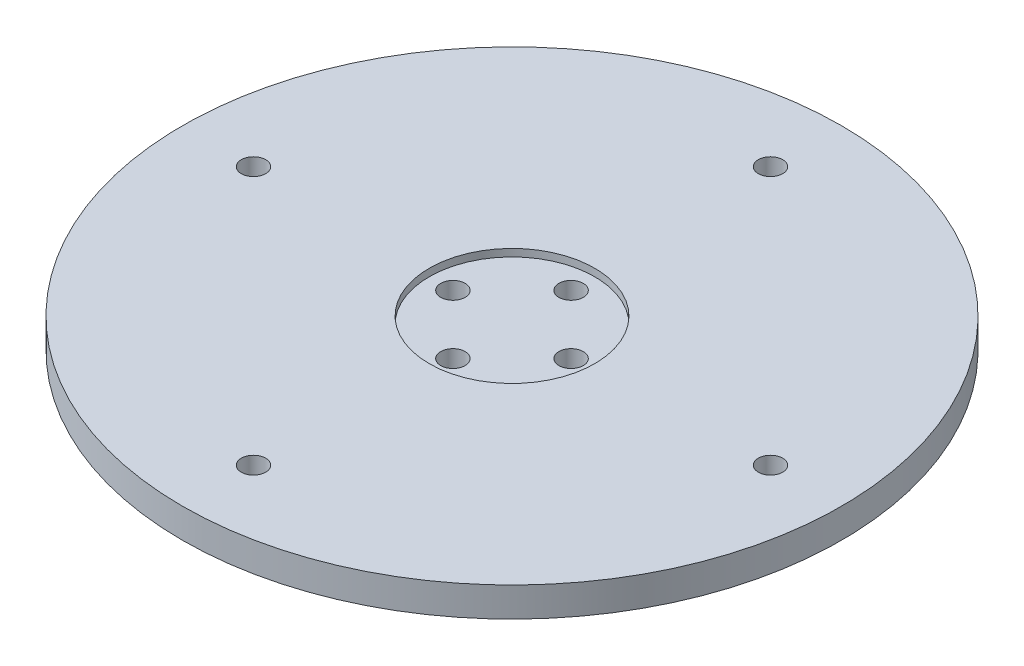
from build123d import *

# Parameters (mm, degrees)
SKETCH1_R           = 44.617697353
SKETCH1_R_2         = 1.65
BOSS_EXTRUDE1_DEPTH = 4
SKETCH2_R           = 11.2
CUT_EXTRUDE1_DEPTH  = 1


with BuildPart() as part:
    # Sketch1 → Boss-Extrude1 (new body)
    with BuildSketch(Plane(origin=(0, 0, 0), x_dir=(1, 0, 0), z_dir=(0, 1, 0))):
        with Locations(Location((0, 0, 0), (0, 0, 270))):
            Circle(SKETCH1_R)
        with Locations(Location((0, 8, 0), (0, 0, 270))):
            Circle(SKETCH1_R_2, mode=Mode.SUBTRACT)
        with Locations(Location((8, 0, 0), (0, 0, 270))):
            Circle(SKETCH1_R_2, mode=Mode.SUBTRACT)
        with Locations(Location((0, -8, 0), (0, 0, 270))):
            Circle(SKETCH1_R_2, mode=Mode.SUBTRACT)
        with Locations(Location((-8, 0, 0), (0, 0, 270))):
            Circle(SKETCH1_R_2, mode=Mode.SUBTRACT)
        with Locations(Location((0, 35, 0), (0, 0, 270))):
            Circle(SKETCH1_R_2, mode=Mode.SUBTRACT)
        with Locations(Location((35, 0, 0), (0, 0, 270))):
            Circle(SKETCH1_R_2, mode=Mode.SUBTRACT)
        with Locations(Location((0, -35, 0), (0, 0, 270))):
            Circle(SKETCH1_R_2, mode=Mode.SUBTRACT)
        with Locations(Location((-35, 0, 0), (0, 0, 270))):
            Circle(SKETCH1_R_2, mode=Mode.SUBTRACT)
    extrude(amount=BOSS_EXTRUDE1_DEPTH)

    # Sketch2 → Cut-Extrude1 (cut)
    with BuildSketch(Plane(origin=(0, 4, 0), x_dir=(1, 0, 0), z_dir=(0, 1, 0))):
        with Locations(Location((0, 0, 0), (0, 0, 270))):
            Circle(SKETCH2_R)
    extrude(amount=-CUT_EXTRUDE1_DEPTH, mode=Mode.SUBTRACT)


solid = part.part
